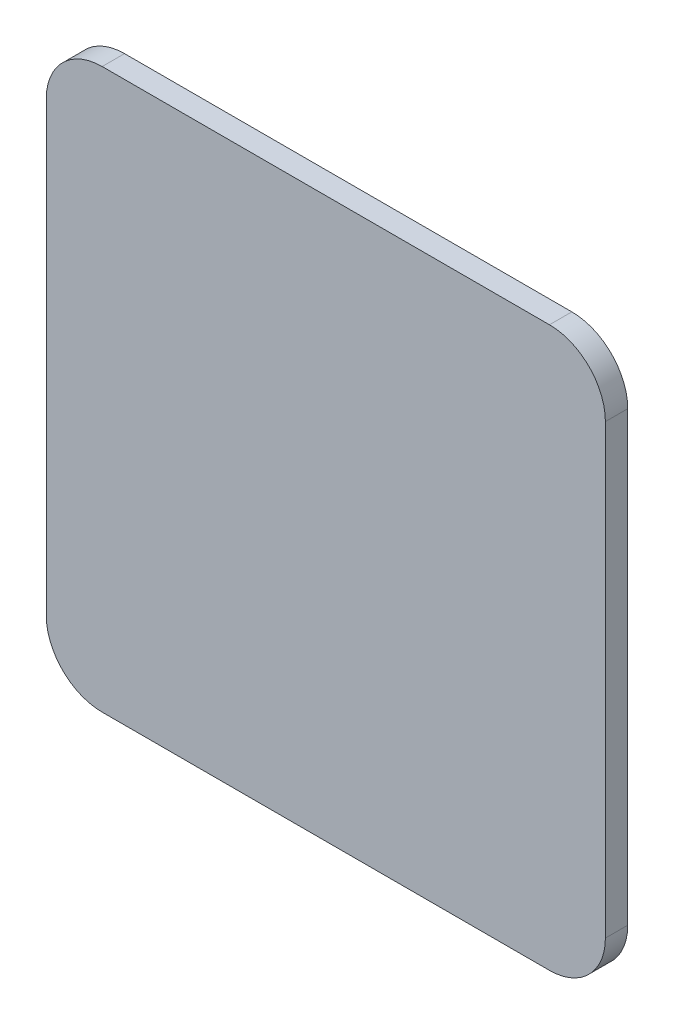
from build123d import *

# Parameters (mm, degrees)
ESQUISSE1_W        = 10
ESQUISSE1_H        = 10
BOSS_EXTRU_1_DEPTH = 0.4
CONG_1_R           = 1


with BuildPart() as part:
    # Esquisse1 → Boss.-Extru.1 (new body)
    with BuildSketch(Plane.XY):
        with Locations((5, 5)):
            Rectangle(ESQUISSE1_W, ESQUISSE1_H)
    extrude(amount=BOSS_EXTRU_1_DEPTH)

    # Congé1
    cong_1_edges = [part.edges().sort_by_distance(p)[0] for p in [
        (0, 10, 0.2),
        (10, 10, 0.2),
        (10, 0, 0.2),
        (0, 0, 0.2),
    ]]
    fillet(cong_1_edges, radius=CONG_1_R)


solid = part.part
